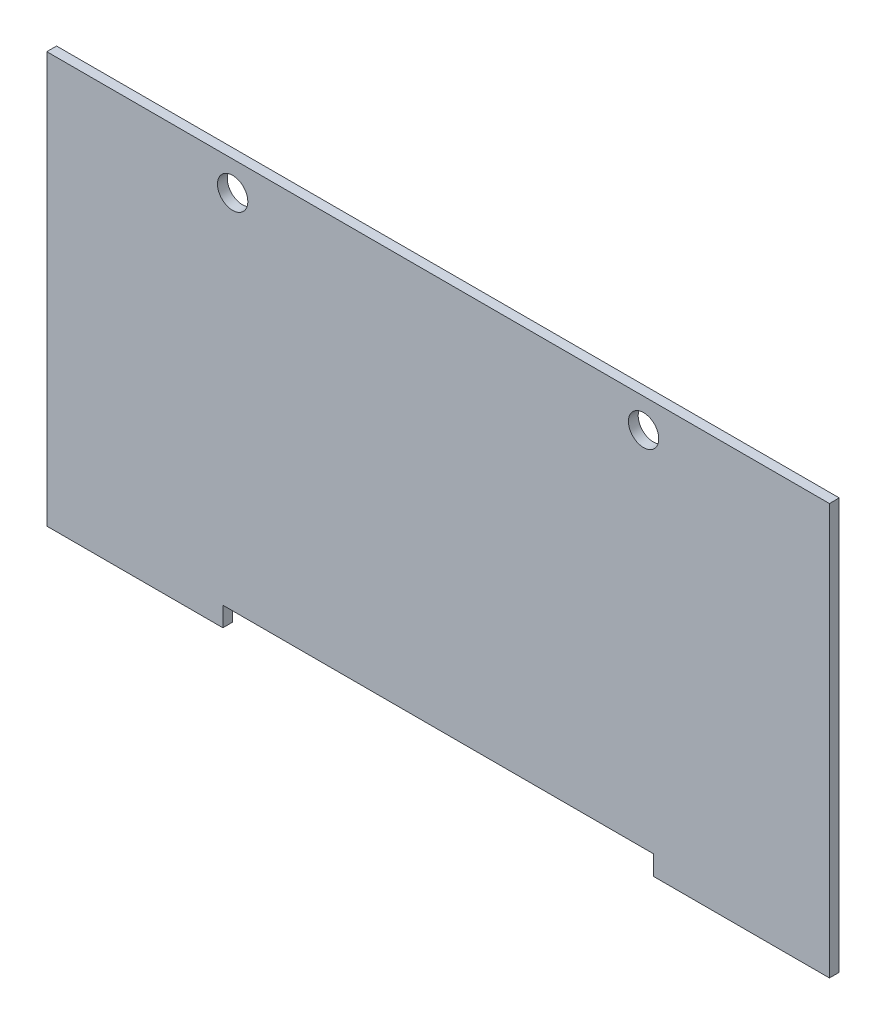
from build123d import *

# Parameters (mm, degrees)
SKETCH_1_R      = 1.55
EXTRUDE_1_DEPTH = 1


with BuildPart() as part:
    # 草图1 → 凸台-拉伸1 (new body)
    with BuildSketch(Plane.XY):
        Polygon((0, 0), (0, 42), (80, 42), (80, 0), (62, 0), (62, 2), (18, 2), (18, 0), align=None)
        with Locations((19, 39)):
            Circle(SKETCH_1_R, mode=Mode.SUBTRACT)
        with Locations((61, 39)):
            Circle(SKETCH_1_R, mode=Mode.SUBTRACT)
    extrude(amount=EXTRUDE_1_DEPTH)


solid = part.part
